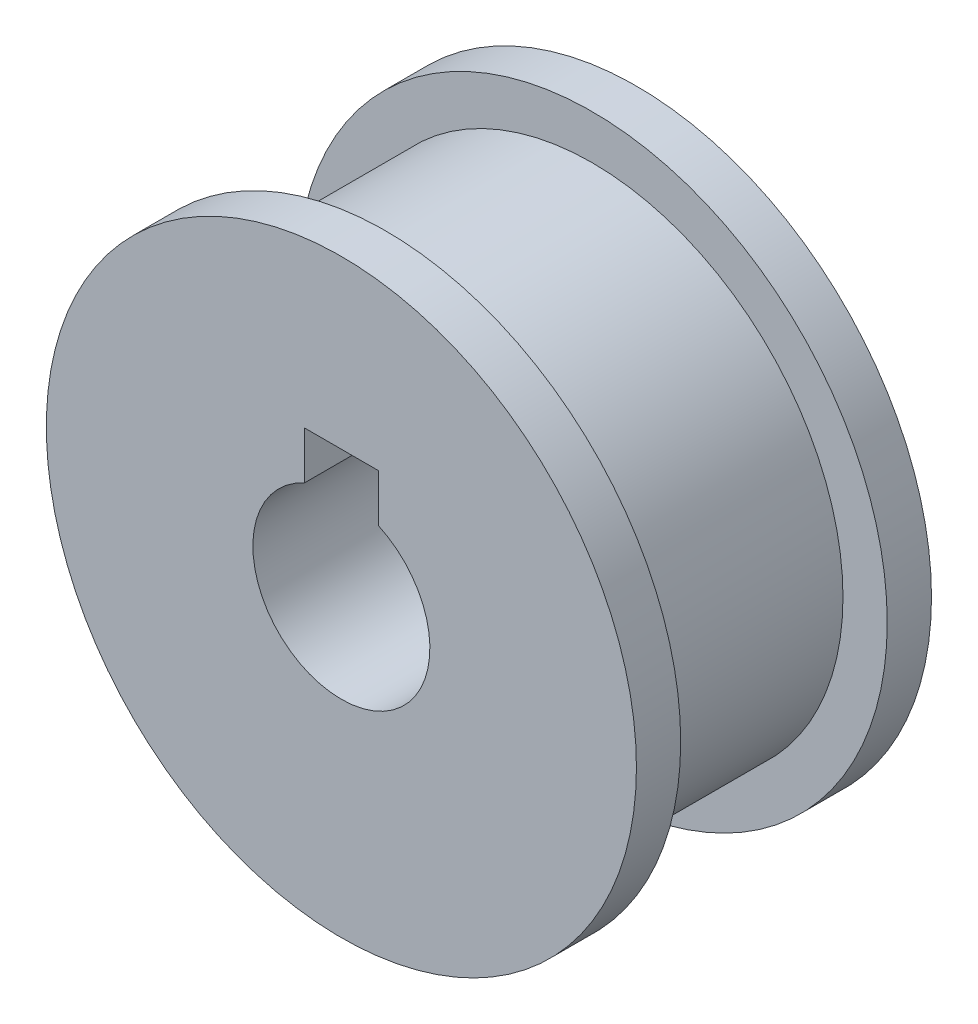
from build123d import *

# Parameters (mm, degrees)
SKETCH_1_R          = 17
EXTRUDE_1_DEPTH     = 10
SKETCH_2_R          = 20
EXTRUDE_2_DEPTH     = 3
CUT_EXTRUDE_1_DEPTH = 35.641016151


with BuildPart() as part:
    # 草图1 → 凸台-拉伸1 (new, symmetric)
    with BuildSketch(Plane.XY):
        Circle(SKETCH_1_R)
    extrude(amount=EXTRUDE_1_DEPTH, both=True)

    # 草图2 → 凸台-拉伸2 (add)
    with BuildSketch(Plane.XY.offset(10)):
        Circle(SKETCH_2_R)
    extrude_2 = extrude(amount=-EXTRUDE_2_DEPTH)

    # 镜向1: 凸台-拉伸2 across plane
    add(extrude_2.mirror(Plane.XY))

    # 草图3 → 切除-拉伸1 (cut, through all)
    with BuildSketch(Plane.XY.offset(10)):
        with BuildLine():
            Line((2.5, 8.68), (-2.5, 8.68))
            Line((-2.5, 8.68), (-2.5, 5.454356057))
            ThreePointArc((-2.5, 5.454356057), (0, -6), (2.5, 5.454356057))
            Line((2.5, 5.454356057), (2.5, 8.68))
        make_face()
    extrude(amount=-CUT_EXTRUDE_1_DEPTH, mode=Mode.SUBTRACT)


solid = part.part
